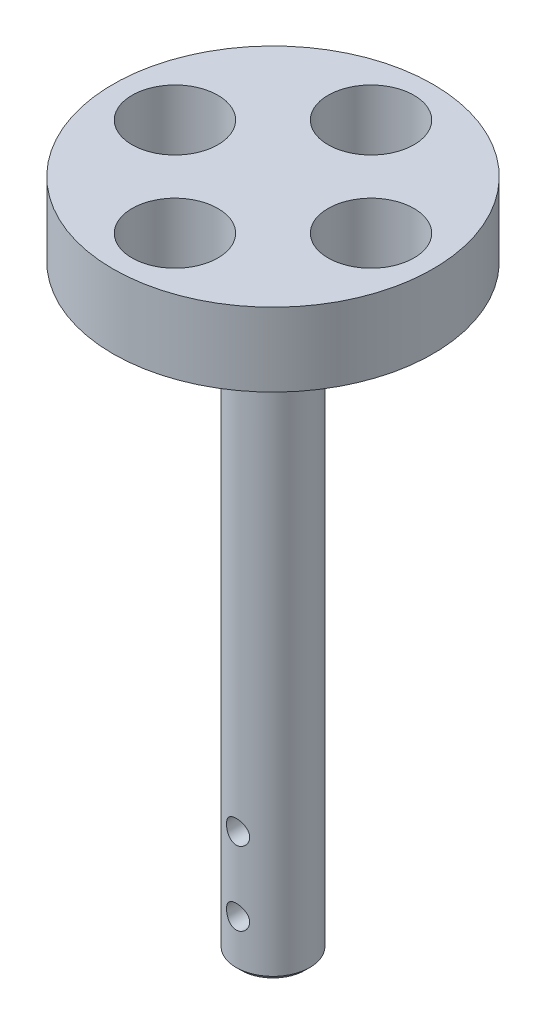
from build123d import *

# Parameters (mm, degrees)
SKETCH1_R               = 20.7264
BOSS_EXTRUDE1_DEPTH     = 9.525
SKETCH2_R               = 5.5626
CUT_EXTRUDE1_DEPTH      = 7.9375
CIRPATTERN1_COUNT       = 4
SKETCH3_R               = 4.7625
BOSS_EXTRUDE2_DEPTH     = 77.47
CUT_EXTRUDE2_DEPTH      = 83.8297544
CUT_EXTRUDE2_DEPTH_BACK = 83.8297544
SKETCH5_R               = 1.5
SKETCH6_R               = 3.175
CUT_EXTRUDE3_DEPTH      = 85.316401939
CIRPATTERN2_COUNT       = 4
CHAMFER1_SIZE           = 0.635


with BuildPart() as part:
    # Sketch1 → Boss-Extrude1 (new body)
    with BuildSketch(Plane(origin=(0, 0, 0), x_dir=(1, 0, 0), z_dir=(0, 1, 0))):
        with Locations(Location((0, 0, 0), (0, 0, 90))):
            Circle(SKETCH1_R)
    extrude(amount=BOSS_EXTRUDE1_DEPTH)

    # Sketch2 → Cut-Extrude1 (cut)
    with BuildSketch(Plane(origin=(0, 9.525, 0), x_dir=(1, 0, 0), z_dir=(0, 1, 0))):
        with Locations(Location((0, 12.7, 0), (0, 0, 270))):
            Circle(SKETCH2_R)
    cut_extrude1 = extrude(amount=-CUT_EXTRUDE1_DEPTH, mode=Mode.SUBTRACT)

    # CirPattern1: Cut-Extrude1 ×4 about axis
    cirpattern1_axis = Axis((0, 0, 0), (0, 1, 0))
    for i in range(1, CIRPATTERN1_COUNT):
        add(cut_extrude1.rotate(cirpattern1_axis, i * 360 / CIRPATTERN1_COUNT), mode=Mode.SUBTRACT)

    # Sketch3 → Boss-Extrude2 (add)
    with BuildSketch(Plane.XZ):
        with Locations(Location((0, 0, 0), (0, 0, 270))):
            Circle(SKETCH3_R)
    extrude(amount=BOSS_EXTRUDE2_DEPTH)

    # Sketch4 → Revolve1 (revolve)
    with BuildSketch(Plane.XY, mode=Mode.PRIVATE) as revolve1_sk:
        Polygon((-20.7264, 0), (-4.7625, -6.35), (-4.7625, 0), align=None)
    revolve(revolve1_sk.sketch.rotate(Axis((0, 0, 0), (0, -1, 0)), 270), axis=Axis((0, 0, 0), (0, -1, 0)))

    # Sketch5 → Cut-Extrude2 (cut, two sides: drawn at the far end of the back side and taken through both)
    with BuildSketch(Plane.XY.offset(-CUT_EXTRUDE2_DEPTH_BACK)):
        with Locations((0, -71.12)):
            Circle(SKETCH5_R)
        with Locations((0, -61.595)):
            Circle(SKETCH5_R)
    extrude(amount=CUT_EXTRUDE2_DEPTH + CUT_EXTRUDE2_DEPTH_BACK, mode=Mode.SUBTRACT)

    # Sketch6 → Cut-Extrude3 (cut, through all)
    with BuildSketch(Plane(origin=(0, 1.5875, 0), x_dir=(1, 0, 0), z_dir=(0, 1, 0))):
        with Locations(Location((-12.7, 0, 0), (0, 0, 270))):
            Circle(SKETCH6_R)
    cut_extrude3 = extrude(amount=-CUT_EXTRUDE3_DEPTH, mode=Mode.SUBTRACT)

    # CirPattern2: Cut-Extrude3 ×4 about axis
    cirpattern2_axis = Axis((0, 0, 0), (0, 1, 0))
    for i in range(1, CIRPATTERN2_COUNT):
        add(cut_extrude3.rotate(cirpattern2_axis, i * 360 / CIRPATTERN2_COUNT), mode=Mode.SUBTRACT)

    # Chamfer1
    chamfer1_edges = [part.edges().sort_by_distance(p)[0] for p in [
        (0, -77.47, 4.7625),
    ]]
    chamfer(chamfer1_edges, length=CHAMFER1_SIZE)


solid = part.part
